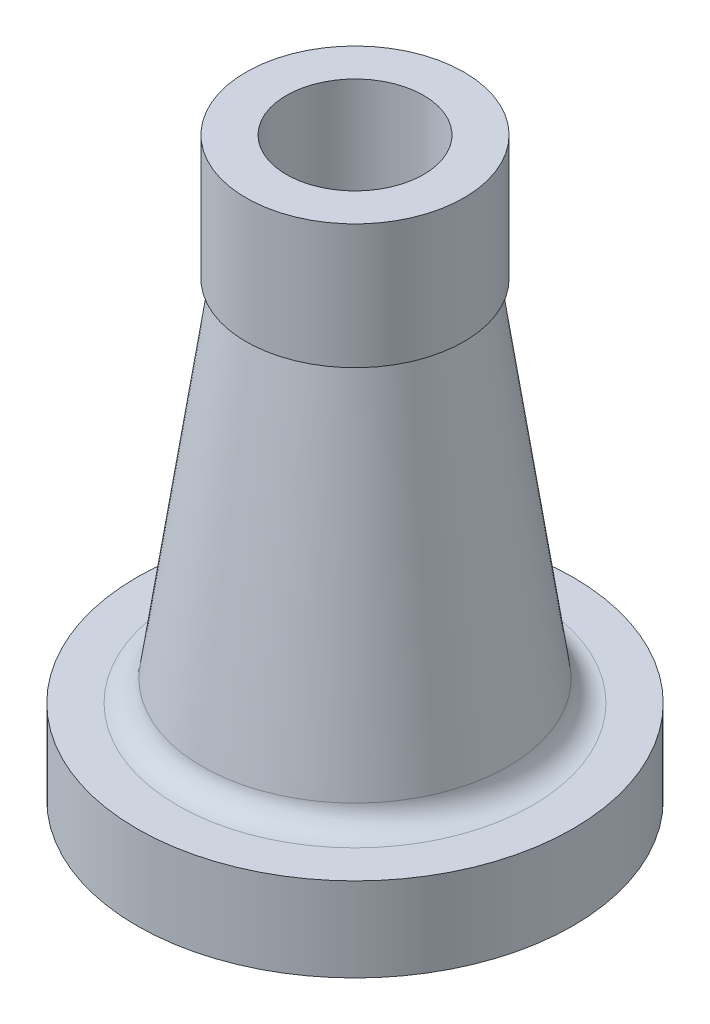
from build123d import *


with BuildPart() as part:
    # Sketch1 → Revolve1 (revolve)
    with BuildSketch(Plane.XY, mode=Mode.PRIVATE) as revolve1_sk:
        with BuildLine():
            Line((-70, 0), (-70, 27))
            Line((-70, 27), (-57, 27))
            ThreePointArc((-57, 27), (-51.763835702, 28.95164622), (-49.082456469, 33.854354139))
            Line((-49.082456469, 33.854354139), (-33, 145))
            Line((-33, 145), (-35, 145))
            Line((-35, 145), (-35, 185))
            Line((-35, 185), (-22.035069811, 185))
            Line((-22.035069811, 185), (-22.035069811, 130))
            Line((-22.035069811, 130), (-40.411605894, 3))
            Line((-40.411605894, 3), (-50, 3))
            Line((-50, 3), (-50, 0))
            Line((-50, 0), (-70, 0))
        make_face()
    revolve(revolve1_sk.sketch.rotate(Axis((0, 0, 0), (0, 1, 0)), 270), axis=Axis((0, 0, 0), (0, 1, 0)))


solid = part.part
